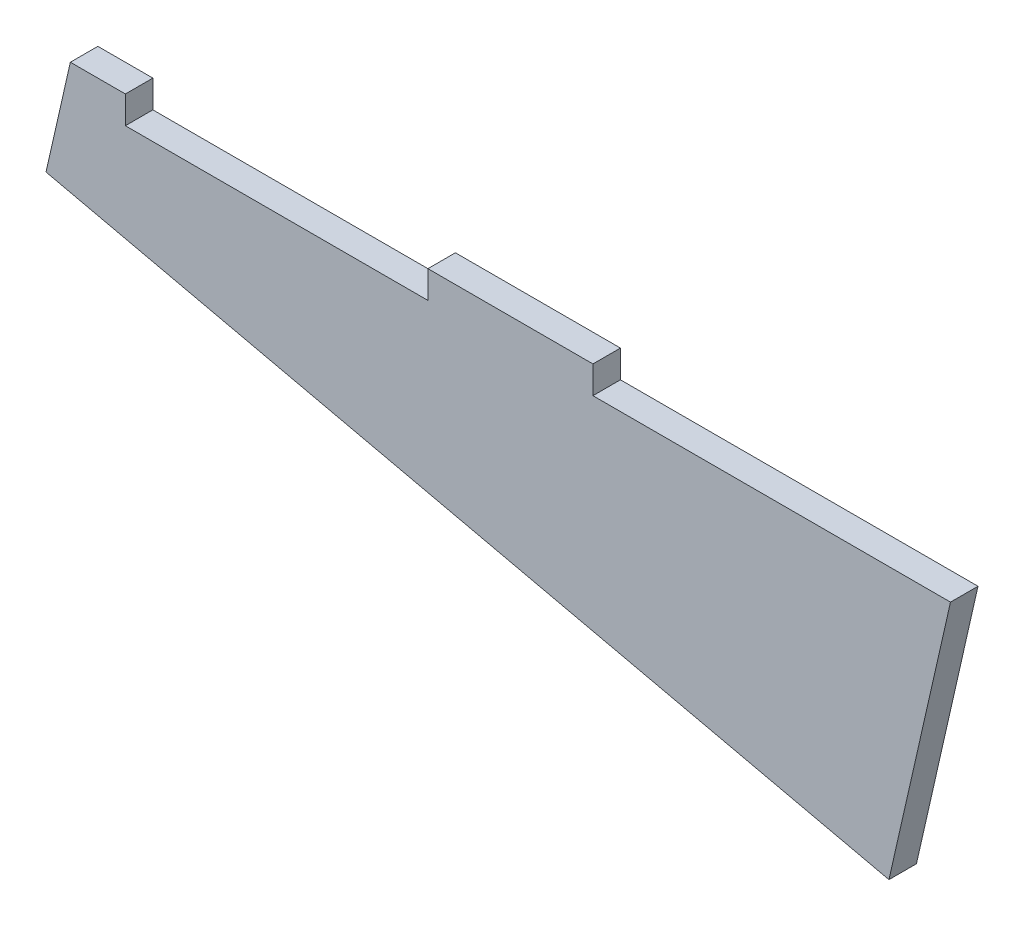
from build123d import *

# Parameters (mm, degrees)
BOSS_EXTRUDE1_DEPTH = 6.35


with BuildPart() as part:
    # Sketch1 → Boss-Extrude1 (new body)
    with BuildSketch(Plane.XY):
        Polygon((-186.45146695, -43.594550399), (-173.75146695, -43.594550399), (-173.75146695, -49.944550399), (-103.90146695, -49.944550399), (-103.90146695, -43.594550399), (-65.80146695, -43.594550399), (-65.80146695, -49.944550399), (16.74853305, -49.944550399), (2.537900009, -112.543454638), (-192.074475734, -68.364325776), align=None)
    extrude(amount=-BOSS_EXTRUDE1_DEPTH)


solid = part.part
